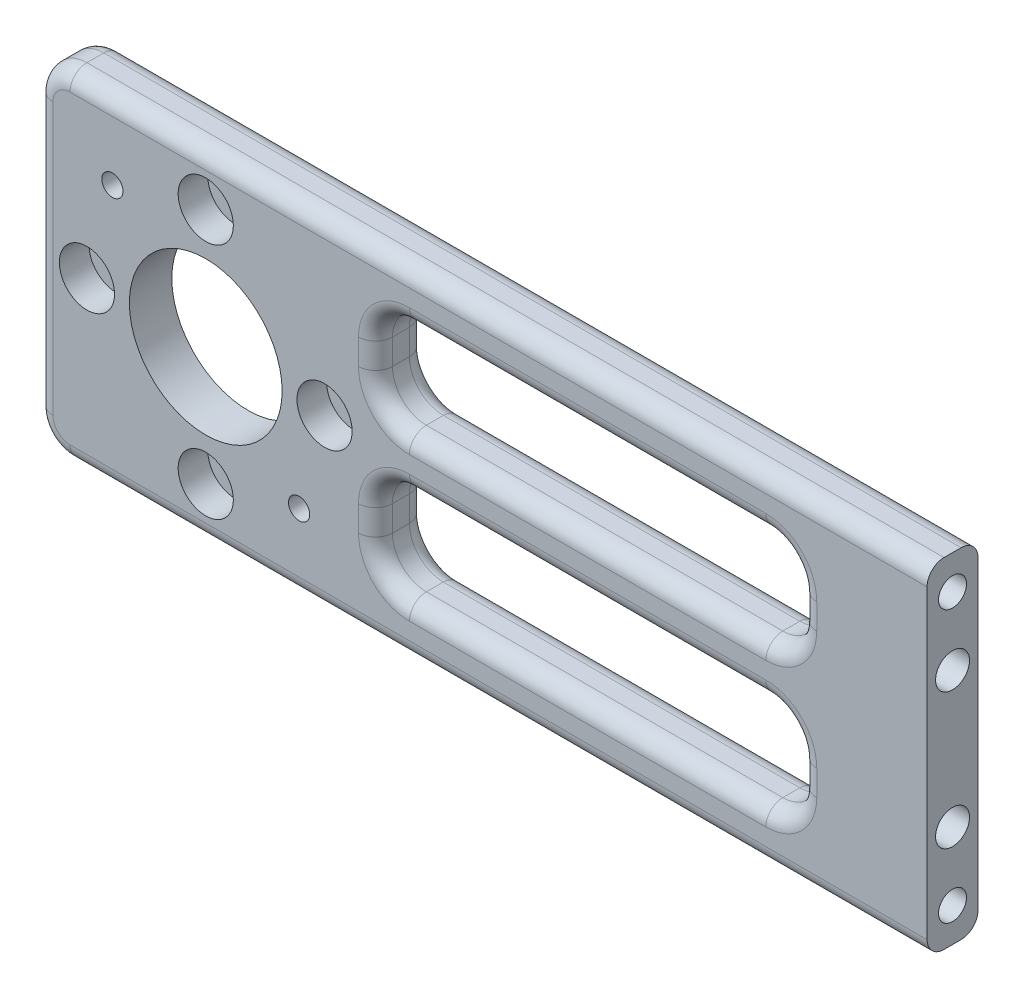
from build123d import *

# Parameters (mm, degrees)
ESQUISSE1_R                                        = 9
BOSS_EXTRU_1_DEPTH                                 = 6
TROU_TARAUD_M31_D                                  = 2.5
DIAM_TRE_DU_PER_AGE_4_0_4_1_D                      = 4
DIAM_TRE_DU_PER_AGE_4_0_4_1_DEPTH                  = 5
DIAM_TRE_DU_PER_AGE_4_0_4_1_TIP                    = 1.201721238
TROU_TARAUD_M41_D                                  = 3.3
TROU_TARAUD_M41_DEPTH                              = 11.5
TROU_TARAUD_M41_TIP                                = 0.991420021
CHAMBRAGE_POUR_VIS_T_TE_HEXAGONALE_M31_D           = 3.2
CHAMBRAGE_POUR_VIS_T_TE_HEXAGONALE_M31_CBORE_D     = 6.5
CHAMBRAGE_POUR_VIS_T_TE_HEXAGONALE_M31_CBORE_DEPTH = 3.5
ENL_V_MAT_EXTRU_1_REACH                            = 89.527
CONG_1_R                                           = 2
ESQUISSE14_R                                       = 17.5
ENL_V_MAT_EXTRU_2_DEPTH                            = 1


with BuildPart() as part:
    # Esquisse1 → Boss.-Extru.1 (new body)
    with BuildSketch(Plane.XY):
        with BuildLine():
            Line((-16, 20), (85, 20))
            Line((85, 20), (85, -20))
            Line((85, -20), (-16, -20))
            ThreePointArc((-16, -20), (-18.828427125, -18.828427125), (-20, -16))
            Line((-20, -16), (-20, 16))
            ThreePointArc((-20, 16), (-18.828427125, 18.828427125), (-16, 20))
        make_face()
        Circle(ESQUISSE1_R, mode=Mode.SUBTRACT)
    extrude(amount=BOSS_EXTRU_1_DEPTH)

    # Trou taraudé M31 (through all)
    with Locations(Plane.XY.offset(6)):
        with Locations((-11, 11), (11, -11)):
            Hole(TROU_TARAUD_M31_D / 2)

    # Diamètre du perçage Ø4.0 (4)1
    with Locations(Plane(origin=(85, 0, 0), x_dir=(0, 0, -1), z_dir=(1, 0, 0))):
        with Locations((-3, 8), (-3, -8)):
            Hole(DIAM_TRE_DU_PER_AGE_4_0_4_1_D / 2, depth=DIAM_TRE_DU_PER_AGE_4_0_4_1_DEPTH)
            with Locations((0, 0, -(DIAM_TRE_DU_PER_AGE_4_0_4_1_DEPTH + DIAM_TRE_DU_PER_AGE_4_0_4_1_TIP / 2))):  # 118° drill point
                Cone(0, DIAM_TRE_DU_PER_AGE_4_0_4_1_D / 2, DIAM_TRE_DU_PER_AGE_4_0_4_1_TIP, mode=Mode.SUBTRACT)

    # Trou taraudé M41
    with Locations(Plane(origin=(85, 0, 0), x_dir=(0, 0, -1), z_dir=(1, 0, 0))):
        with Locations((-3, 16), (-3, -16)):
            Hole(TROU_TARAUD_M41_D / 2, depth=TROU_TARAUD_M41_DEPTH)
            with Locations((0, 0, -(TROU_TARAUD_M41_DEPTH + TROU_TARAUD_M41_TIP / 2))):  # 118° drill point
                Cone(0, TROU_TARAUD_M41_D / 2, TROU_TARAUD_M41_TIP, mode=Mode.SUBTRACT)

    # Chambrage pour vis à tête hexagonale M31 (through all)
    with Locations(Plane.XY.offset(6)):
        with Locations((0, 14), (14, 0), (0, -14), (-14, 0)):
            CounterBoreHole(CHAMBRAGE_POUR_VIS_T_TE_HEXAGONALE_M31_D / 2, CHAMBRAGE_POUR_VIS_T_TE_HEXAGONALE_M31_CBORE_D / 2, CHAMBRAGE_POUR_VIS_T_TE_HEXAGONALE_M31_CBORE_DEPTH)

    # Esquisse13 → Enlèv. mat.-Extru.1 (cut, up to next)
    with BuildSketch(Plane.XY.offset(6), mode=Mode.PRIVATE) as enl_v_mat_extru_1_sk1:
        with BuildLine():
            Line((20, 10), (20, 7))
            ThreePointArc((20, 7), (21.171572875, 4.171572875), (24, 3))
            Line((24, 3), (66, 3))
            ThreePointArc((66, 3), (68.828427125, 4.171572875), (70, 7))
            Line((70, 7), (70, 10))
            ThreePointArc((70, 10), (68.828427125, 12.828427125), (66, 14))
            Line((66, 14), (24, 14))
            ThreePointArc((24, 14), (21.171572875, 12.828427125), (20, 10))
        make_face()
    enl_v_mat_extru_1_tool1 = extrude(enl_v_mat_extru_1_sk1.sketch, amount=-ENL_V_MAT_EXTRU_1_REACH, mode=Mode.PRIVATE) & part.part
    # Esquisse13 → Enlèv. mat.-Extru.1 (cut, up to next)
    with BuildSketch(Plane.XY.offset(6), mode=Mode.PRIVATE) as enl_v_mat_extru_1_sk2:
        with BuildLine():
            Line((20, -7), (20, -10))
            ThreePointArc((20, -10), (21.171572875, -12.828427125), (24, -14))
            Line((24, -14), (66, -14))
            ThreePointArc((66, -14), (68.828427125, -12.828427125), (70, -10))
            Line((70, -10), (70, -7))
            ThreePointArc((70, -7), (68.828427125, -4.171572875), (66, -3))
            Line((66, -3), (24, -3))
            ThreePointArc((24, -3), (21.171572875, -4.171572875), (20, -7))
        make_face()
    enl_v_mat_extru_1_tool2 = extrude(enl_v_mat_extru_1_sk2.sketch, amount=-ENL_V_MAT_EXTRU_1_REACH, mode=Mode.PRIVATE) & part.part
    add(enl_v_mat_extru_1_tool1.solids().sort_by_distance((45, 8.5, 6))[0], mode=Mode.SUBTRACT)
    add(enl_v_mat_extru_1_tool2.solids().sort_by_distance((45, -8.5, 6))[0], mode=Mode.SUBTRACT)

    # Congé1
    cong_1_edges = [part.edges().sort_by_distance(p)[0] for p in [
        (-18.828427125, 18.828427125, 6),
        (68.828427125, -12.828427125, 0),
        (45, -14, 0),
        (21.171572875, -12.828427125, 0),
        (20, -8.5, 0),
        (21.171572875, -4.171572875, 0),
        (45, -3, 0),
        (68.828427125, -4.171572875, 0),
        (70, -8.5, 0),
        (68.828427125, -12.828427125, 6),
        (70, -8.5, 6),
        (68.828427125, -4.171572875, 6),
        (45, -3, 6),
        (21.171572875, -4.171572875, 6),
        (20, -8.5, 6),
        (21.171572875, -12.828427125, 6),
        (45, -14, 6),
        (-20, 0, 6),
        (-18.828427125, -18.828427125, 6),
        (34.5, -20, 6),
        (34.5, -20, 0),
        (-18.828427125, -18.828427125, 0),
        (-20, 0, 0),
        (34.5, 20, 6),
        (-18.828427125, 18.828427125, 0),
        (34.5, 20, 0),
        (68.828427125, 4.171572875, 0),
        (45, 3, 0),
        (21.171572875, 4.171572875, 0),
        (20, 8.5, 0),
        (21.171572875, 12.828427125, 0),
        (45, 14, 0),
        (68.828427125, 12.828427125, 0),
        (70, 8.5, 0),
        (68.828427125, 4.171572875, 6),
        (70, 8.5, 6),
        (68.828427125, 12.828427125, 6),
        (45, 14, 6),
        (21.171572875, 12.828427125, 6),
        (20, 8.5, 6),
        (21.171572875, 4.171572875, 6),
        (45, 3, 6),
    ]]
    fillet(cong_1_edges, radius=CONG_1_R)

    # Esquisse14 → Enlèv. mat.-Extru.2 (cut)
    with BuildSketch(Plane(origin=(0, 0, 0), x_dir=(-1, 0, 0), z_dir=(0, 0, -1))):
        Circle(ESQUISSE14_R)
    extrude(amount=-ENL_V_MAT_EXTRU_2_DEPTH, mode=Mode.SUBTRACT)


solid = part.part
